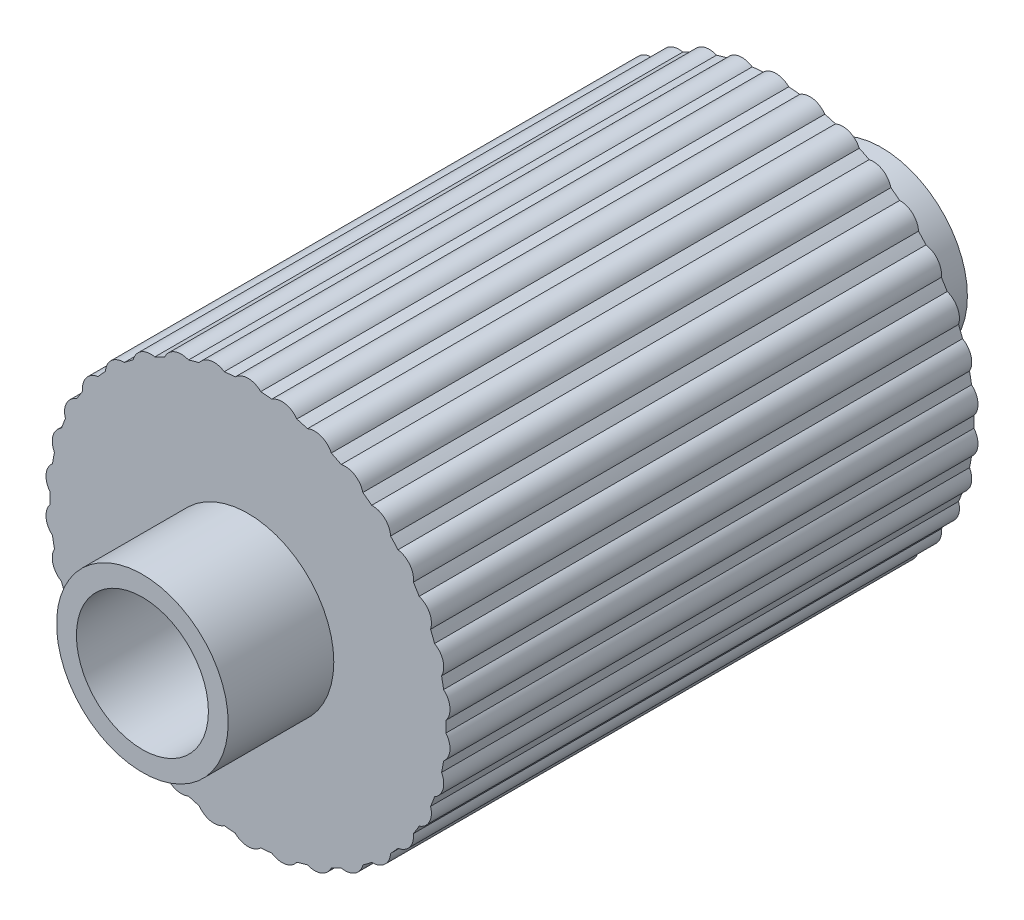
from build123d import *

# Parameters (mm, degrees)
SKETCH1_R               = 5
BOSS_EXTRUDE1_DEPTH     = 40
SKETCH2_R               = 6.5
BOSS_EXTRUDE2_DEPTH     = 8
CUT_EXTRUDE1_DEPTH      = 53.671192562
CUT_EXTRUDE1_DEPTH_BACK = 53.671192562
SKETCH3_R               = 5
SKETCH4_R               = 5
CUT_EXTRUDE2_DEPTH      = 61.052098431


with BuildPart() as part:
    # Sketch1 → Boss-Extrude1 (new body)
    with BuildSketch(Plane.XY):
        with BuildLine():
            ThreePointArc((-3.700263623, 14.536438667), (-4.104944851, 14.427384648), (-4.506421309, 14.30706703))
            ThreePointArc((-4.506421309, 14.30706703), (-5.549993278, 14.326184075), (-6.308323199, 13.609006518))
            ThreePointArc((-6.308323199, 13.609006518), (-6.686075337, 13.42744937), (-7.05860759, 13.235409283))
            ThreePointArc((-7.05860759, 13.235409283), (-8.087923512, 13.062444978), (-8.701560395, 12.218135975))
            ThreePointArc((-8.701560395, 12.218135975), (-9.039519546, 11.970258409), (-9.370421456, 11.713035547))
            ThreePointArc((-9.370421456, 11.713035547), (-10.350429211, 11.353879984), (-10.798476387, 10.411191465))
            ThreePointArc((-10.798476387, 10.411191465), (-11.085133758, 10.105434655), (-11.363136858, 9.791788434))
            ThreePointArc((-11.363136858, 9.791788434), (-12.260463457, 9.258672225), (-12.527663218, 8.249706316))
            ThreePointArc((-12.527663218, 8.249706316), (-12.753257036, 7.896482443), (-12.968894263, 7.53709371))
            ThreePointArc((-12.968894263, 7.53709371), (-13.752982325, 6.848171487), (-13.830235503, 5.807287313))
            ThreePointArc((-13.830235503, 5.807287313), (-13.987083441, 5.418624993), (-14.133011528, 5.025732299))
            ThreePointArc((-14.133011528, 5.025732299), (-14.777159874, 4.204464483), (-14.661835705, 3.167108106))
            ThreePointArc((-14.661835705, 3.167108106), (-14.744596495, 2.756242767), (-14.815846036, 2.343225603))
            ThreePointArc((-14.815846036, 2.343225603), (-15.298118968, 1.417579484), (-14.994144677, 0.419076831))
            ThreePointArc((-14.994144677, 0.419076831), (-15, 0), (-14.994144677, -0.419076831))
            ThreePointArc((-14.994144677, -0.419076831), (-15.298118968, -1.417579484), (-14.815846036, -2.343225603))
            ThreePointArc((-14.815846036, -2.343225603), (-14.744596495, -2.756242767), (-14.661835705, -3.167108106))
            ThreePointArc((-14.661835705, -3.167108106), (-14.777159874, -4.204464483), (-14.133011528, -5.025732299))
            ThreePointArc((-14.133011528, -5.025732299), (-13.987083441, -5.418624993), (-13.830235503, -5.807287313))
            ThreePointArc((-13.830235503, -5.807287313), (-13.752982325, -6.848171487), (-12.968894263, -7.53709371))
            ThreePointArc((-12.968894263, -7.53709371), (-12.753257036, -7.896482443), (-12.527663218, -8.249706316))
            ThreePointArc((-12.527663218, -8.249706316), (-12.260463457, -9.258672225), (-11.363136858, -9.791788434))
            ThreePointArc((-11.363136858, -9.791788434), (-11.085133758, -10.105434655), (-10.798476387, -10.411191465))
            ThreePointArc((-10.798476387, -10.411191465), (-10.350429211, -11.353879984), (-9.370421456, -11.713035547))
            ThreePointArc((-9.370421456, -11.713035547), (-9.039519546, -11.970258409), (-8.701560395, -12.218135975))
            ThreePointArc((-8.701560395, -12.218135975), (-8.087923512, -13.062444978), (-7.05860759, -13.235409283))
            ThreePointArc((-7.05860759, -13.235409283), (-6.686075337, -13.42744937), (-6.308323199, -13.609006518))
            ThreePointArc((-6.308323199, -13.609006518), (-5.549993278, -14.326184075), (-4.506421309, -14.30706703))
            ThreePointArc((-4.506421309, -14.30706703), (-4.104944851, -14.427384648), (-3.700263623, -14.536438667))
            ThreePointArc((-3.700263623, -14.536438667), (-2.82306468, -15.102062156), (-1.800774254, -14.891514768))
            ThreePointArc((-1.800774254, -14.891514768), (-1.384025392, -14.936012644), (-0.966196008, -14.968849831))
            ThreePointArc((-0.966196008, -14.968849831), (0, -15.363657622), (0.966196008, -14.968849831))
            ThreePointArc((0.966196008, -14.968849831), (1.384025392, -14.936012644), (1.800774254, -14.891514768))
            ThreePointArc((1.800774254, -14.891514768), (2.82306468, -15.102062156), (3.700263623, -14.536438667))
            ThreePointArc((3.700263623, -14.536438667), (4.104944851, -14.427384648), (4.506421309, -14.30706703))
            ThreePointArc((4.506421309, -14.30706703), (5.549993278, -14.326184075), (6.308323199, -13.609006518))
            ThreePointArc((6.308323199, -13.609006518), (6.686075337, -13.42744937), (7.05860759, -13.235409283))
            ThreePointArc((7.05860759, -13.235409283), (8.087923512, -13.062444978), (8.701560395, -12.218135975))
            ThreePointArc((8.701560395, -12.218135975), (9.039519546, -11.970258409), (9.370421456, -11.713035547))
            ThreePointArc((9.370421456, -11.713035547), (10.350429211, -11.353879984), (10.798476387, -10.411191465))
            ThreePointArc((10.798476387, -10.411191465), (11.085133758, -10.105434655), (11.363136858, -9.791788434))
            ThreePointArc((11.363136858, -9.791788434), (12.260463457, -9.258672225), (12.527663218, -8.249706316))
            ThreePointArc((12.527663218, -8.249706316), (12.753257036, -7.896482443), (12.968894263, -7.53709371))
            ThreePointArc((12.968894263, -7.53709371), (13.752982325, -6.848171487), (13.830235503, -5.807287313))
            ThreePointArc((13.830235503, -5.807287313), (13.987083441, -5.418624993), (14.133011528, -5.025732299))
            ThreePointArc((14.133011528, -5.025732299), (14.777159874, -4.204464483), (14.661835705, -3.167108106))
            ThreePointArc((14.661835705, -3.167108106), (14.744596495, -2.756242767), (14.815846036, -2.343225603))
            ThreePointArc((14.815846036, -2.343225603), (15.298118968, -1.417579484), (14.994144677, -0.419076831))
            ThreePointArc((14.994144677, -0.419076831), (15, 0), (14.994144677, 0.419076831))
            ThreePointArc((14.994144677, 0.419076831), (15.298118968, 1.417579484), (14.815846036, 2.343225603))
            ThreePointArc((14.815846036, 2.343225603), (14.744596495, 2.756242767), (14.661835705, 3.167108106))
            ThreePointArc((14.661835705, 3.167108106), (14.777159874, 4.204464483), (14.133011528, 5.025732299))
            ThreePointArc((14.133011528, 5.025732299), (13.987083441, 5.418624993), (13.830235503, 5.807287313))
            ThreePointArc((13.830235503, 5.807287313), (13.752982325, 6.848171487), (12.968894263, 7.53709371))
            ThreePointArc((12.968894263, 7.53709371), (12.753257036, 7.896482443), (12.527663218, 8.249706316))
            ThreePointArc((12.527663218, 8.249706316), (12.260463457, 9.258672225), (11.363136858, 9.791788434))
            ThreePointArc((11.363136858, 9.791788434), (11.085133758, 10.105434655), (10.798476387, 10.411191465))
            ThreePointArc((10.798476387, 10.411191465), (10.350429211, 11.353879984), (9.370421456, 11.713035547))
            ThreePointArc((9.370421456, 11.713035547), (9.039519546, 11.970258409), (8.701560395, 12.218135975))
            ThreePointArc((8.701560395, 12.218135975), (8.087923512, 13.062444978), (7.05860759, 13.235409283))
            ThreePointArc((7.05860759, 13.235409283), (6.686075337, 13.42744937), (6.308323199, 13.609006518))
            ThreePointArc((6.308323199, 13.609006518), (5.549993278, 14.326184075), (4.506421309, 14.30706703))
            ThreePointArc((4.506421309, 14.30706703), (4.104944851, 14.427384648), (3.700263623, 14.536438667))
            ThreePointArc((3.700263623, 14.536438667), (2.82306468, 15.102062156), (1.800774254, 14.891514768))
            ThreePointArc((1.800774254, 14.891514768), (1.384025392, 14.936012644), (0.966196008, 14.968849831))
            ThreePointArc((0.966196008, 14.968849831), (0, 15.363657622), (-0.966196008, 14.968849831))
            ThreePointArc((-0.966196008, 14.968849831), (-1.384025392, 14.936012644), (-1.800774254, 14.891514768))
            ThreePointArc((-1.800774254, 14.891514768), (-2.82306468, 15.102062156), (-3.700263623, 14.536438667))
        make_face()
        Circle(SKETCH1_R, mode=Mode.SUBTRACT)
    extrude(amount=BOSS_EXTRUDE1_DEPTH)

    # Sketch2 → Boss-Extrude2 (add)
    with BuildSketch(Plane.XY.offset(40)):
        Circle(SKETCH2_R)
    boss_extrude2 = extrude(amount=BOSS_EXTRUDE2_DEPTH)

    # Sketch3 → Cut-Extrude1 (cut, two sides: drawn at the far end of the back side and taken through both)
    with BuildSketch(Plane.XY.offset(48).offset(-CUT_EXTRUDE1_DEPTH_BACK)):
        Circle(SKETCH3_R)
    extrude(amount=CUT_EXTRUDE1_DEPTH + CUT_EXTRUDE1_DEPTH_BACK, mode=Mode.SUBTRACT)

    # Mirror1: Boss-Extrude2 across plane
    add(boss_extrude2.mirror(Plane(origin=(0, 0, 20), x_dir=(1, 0, 0), z_dir=(0, 0, -1))))

    # Sketch4 → Cut-Extrude2 (cut, through all)
    with BuildSketch(Plane(origin=(0, 0, -8), x_dir=(-1, 0, 0), z_dir=(0, 0, -1))):
        Circle(SKETCH4_R)
    extrude(amount=-CUT_EXTRUDE2_DEPTH, mode=Mode.SUBTRACT)


solid = part.part
